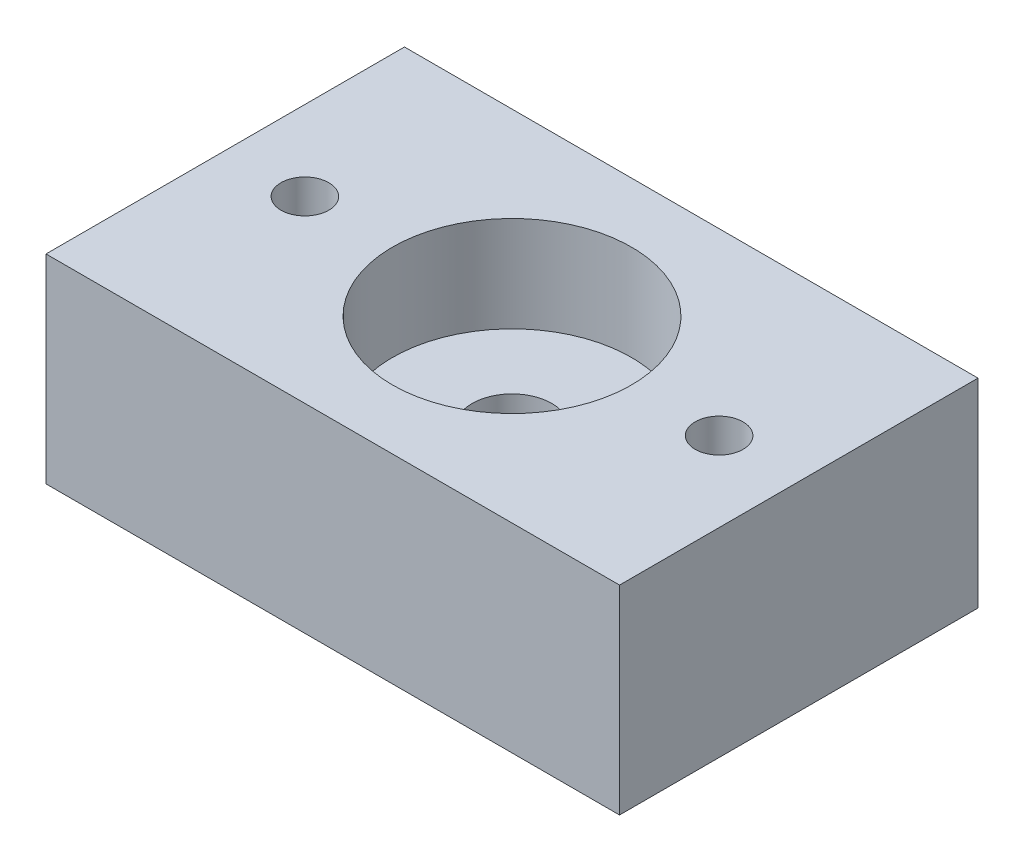
from build123d import *

# Parameters (mm, degrees)
SKETCH1_W           = 72
SKETCH1_H           = 45
BOSS_EXTRUDE1_DEPTH = 25
SKETCH2_R           = 5
CUT_EXTRUDE1_DEPTH  = 50.267129001
SKETCH3_R           = 3
CUT_EXTRUDE2_DEPTH  = 50.267129001
SKETCH4_R           = 15
CUT_EXTRUDE3_DEPTH  = 12


with BuildPart() as part:
    # Sketch1 → Boss-Extrude1 (new body)
    with BuildSketch(Plane(origin=(0, 0, 0), x_dir=(1, 0, 0), z_dir=(0, 1, 0))):
        Rectangle(SKETCH1_W, SKETCH1_H)
    extrude(amount=BOSS_EXTRUDE1_DEPTH)

    # Sketch2 → Cut-Extrude1 (cut, through all)
    with BuildSketch(Plane(origin=(0, 25, 0), x_dir=(1, 0, 0), z_dir=(0, 1, 0))):
        with Locations(Location((0, 0, 0), (0, 0, 270))):
            Circle(SKETCH2_R)
    extrude(amount=-CUT_EXTRUDE1_DEPTH, mode=Mode.SUBTRACT)

    # Sketch3 → Cut-Extrude2 (cut, through all)
    with BuildSketch(Plane(origin=(0, 25, 0), x_dir=(1, 0, 0), z_dir=(0, 1, 0))):
        with Locations(Location((-26, 0, 0), (0, 0, 270))):
            Circle(SKETCH3_R)
        with Locations(Location((26, 0, 0), (0, 0, 90))):
            Circle(SKETCH3_R)
    extrude(amount=-CUT_EXTRUDE2_DEPTH, mode=Mode.SUBTRACT)

    # Sketch4 → Cut-Extrude3 (cut)
    with BuildSketch(Plane(origin=(0, 25, 0), x_dir=(1, 0, 0), z_dir=(0, 1, 0))):
        with Locations(Location((0, 0, 0), (0, 0, 270))):
            Circle(SKETCH4_R)
    extrude(amount=-CUT_EXTRUDE3_DEPTH, mode=Mode.SUBTRACT)


solid = part.part
